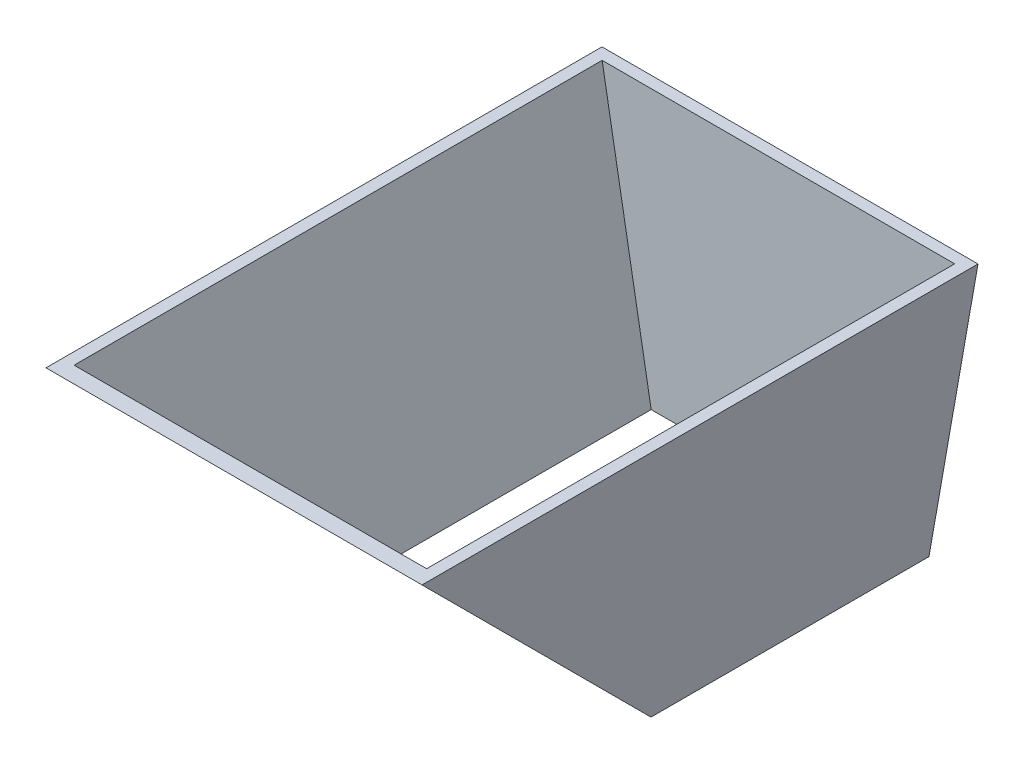
from build123d import *

# Parameters (mm, degrees)
BOSS_EXTRUDE1_DEPTH     = 120
CUT_EXTRUDE1_DEPTH      = 131.179512464
CUT_EXTRUDE1_DEPTH_BACK = 131.179512464
SHELL1_T                = -2.5


with BuildPart() as part:
    # Sketch1 → Boss-Extrude1 (new body)
    with BuildSketch(Plane.XY):
        Polygon((-40.579618843, 30), (40.579618843, 30), (30, -30), (-30, -30), align=None)
    extrude(amount=BOSS_EXTRUDE1_DEPTH)

    # Sketch2 → Cut-Extrude1 (cut, two sides: drawn at the far end of the back side and taken through both)
    with BuildSketch(Plane(origin=(0, 0, 0), x_dir=(0, 0, -1), z_dir=(1, 0, 0)).offset(-CUT_EXTRUDE1_DEPTH_BACK)):
        Polygon((-120, 30), (-120, -30), (-60, -30), align=None)
    extrude(amount=CUT_EXTRUDE1_DEPTH + CUT_EXTRUDE1_DEPTH_BACK, mode=Mode.SUBTRACT)

    # Shell1
    shell1_openings = [part.faces().sort_by_distance(p)[0] for p in [
        (0, -30, 30),
        (0, 30, 60),
    ]]
    offset(amount=SHELL1_T, openings=shell1_openings, kind=Kind.INTERSECTION)


solid = part.part
